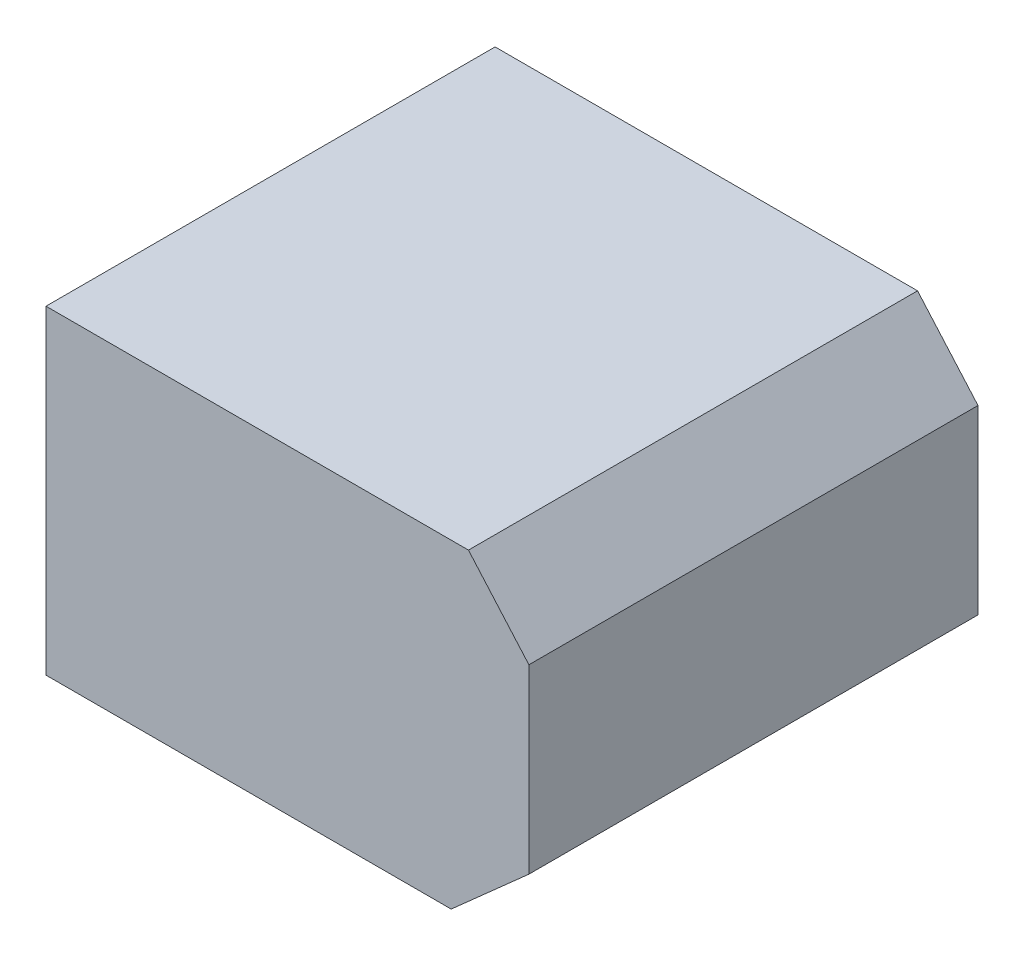
from build123d import *

# Parameters (mm, degrees)
CLOSING_LIP_PROFILE_DEPTH = 52
SHELL_1_T                 = -5


with BuildPart() as part:
    # 草图1 → Closing_lip_profile (new body)
    with BuildSketch(Plane.XY):
        Polygon((-0.915165953, 0), (48, 0), (55, -8), (55, -29), (46, -37), (-0.915165953, -37), align=None)
    extrude(amount=CLOSING_LIP_PROFILE_DEPTH)

    # 抽壳1
    shell_1_openings = [part.faces().sort_by_distance(p)[0] for p in [
        (-0.915165953, -18.5, 26),
    ]]
    offset(amount=SHELL_1_T, openings=shell_1_openings, kind=Kind.INTERSECTION)


solid = part.part
